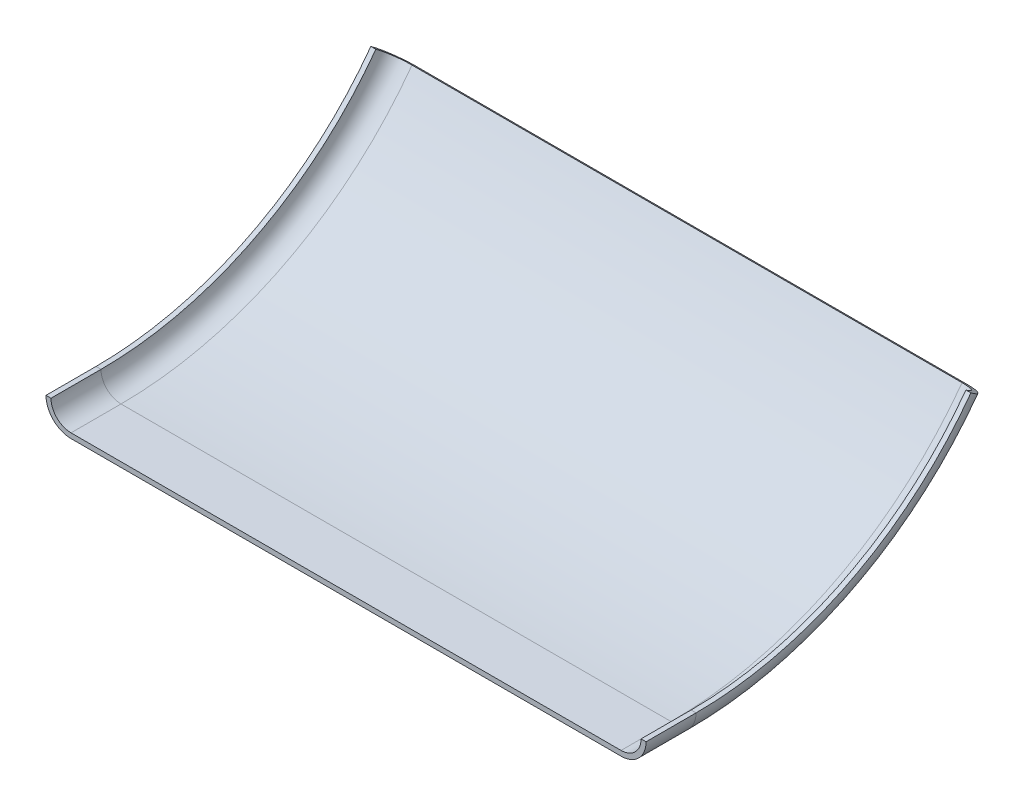
from build123d import *


with BuildPart() as part:
    # Sweep1: sweep along a path in Sketch2
    with BuildLine(Plane(origin=(0, 0, 0), x_dir=(0, 0, -1), z_dir=(1, 0, 0))) as sweep1_path:
        Line((0, 0), (25.4, 0))
        ThreePointArc((25.4, 0), (109.460186176, 20.143967187), (175.26, 76.2))
    # Sketch1 → Sweep1 (sweep)
    with BuildSketch(Plane.XY):
        with BuildLine():
            Line((-139.7, 0), (139.7, 0))
            ThreePointArc((139.7, 0), (148.680256121, 3.719743879), (152.4, 12.7))
            Line((152.4, 12.7), (149.86, 12.7))
            ThreePointArc((149.86, 12.7), (146.884204897, 5.515795103), (139.7, 2.54))
            Line((139.7, 2.54), (-139.7, 2.54))
            ThreePointArc((-139.7, 2.54), (-146.884204897, 5.515795103), (-149.86, 12.7))
            Line((-149.86, 12.7), (-152.4, 12.7))
            ThreePointArc((-152.4, 12.7), (-148.680256121, 3.719743879), (-139.7, 0))
        make_face()
    sweep(path=sweep1_path.line)


solid = part.part
